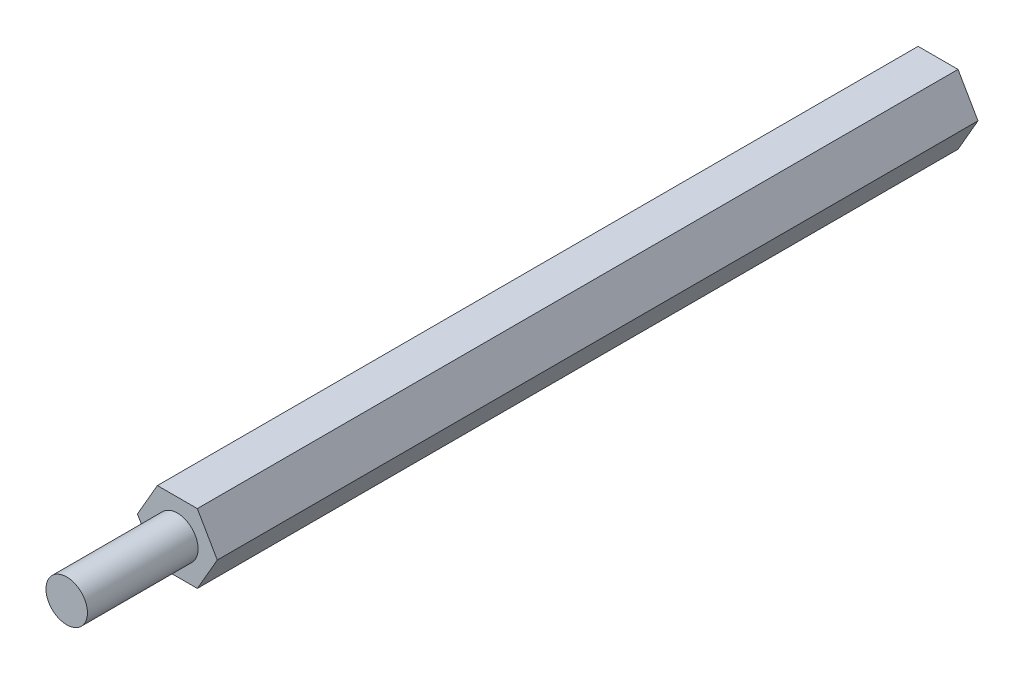
from build123d import *

# Parameters (mm, degrees)
EXTRUDE_1_DEPTH = 55
SKETCH_2_R      = 1.5
EXTRUDE_2_DEPTH = 8
M3X0_5_1_D      = 2.5
M3X0_5_1_DEPTH  = 11
M3X0_5_1_TIP    = 0.751075774


with BuildPart() as part:
    # 草图1 → 拉伸1 (new body)
    with BuildSketch(Plane.XY):
        Polygon((1.443375673, -2.5), (2.886751346, 0), (1.443375673, 2.5), (-1.443375673, 2.5), (-2.886751346, 0), (-1.443375673, -2.5), align=None)
    extrude(amount=EXTRUDE_1_DEPTH)

    # 草图2 → 拉伸2 (add)
    with BuildSketch(Plane.XY.offset(55)):
        Circle(SKETCH_2_R)
    extrude(amount=EXTRUDE_2_DEPTH)

    # M3x0.5 螺纹孔1
    with Locations(Plane(origin=(0, 0, 0), x_dir=(-1, 0, 0), z_dir=(0, 0, -1))):
        with Locations((0, 0)):
            Hole(M3X0_5_1_D / 2, depth=M3X0_5_1_DEPTH)
            with Locations((0, 0, -(M3X0_5_1_DEPTH + M3X0_5_1_TIP / 2))):  # 118° drill point
                Cone(0, M3X0_5_1_D / 2, M3X0_5_1_TIP, mode=Mode.SUBTRACT)


solid = part.part
